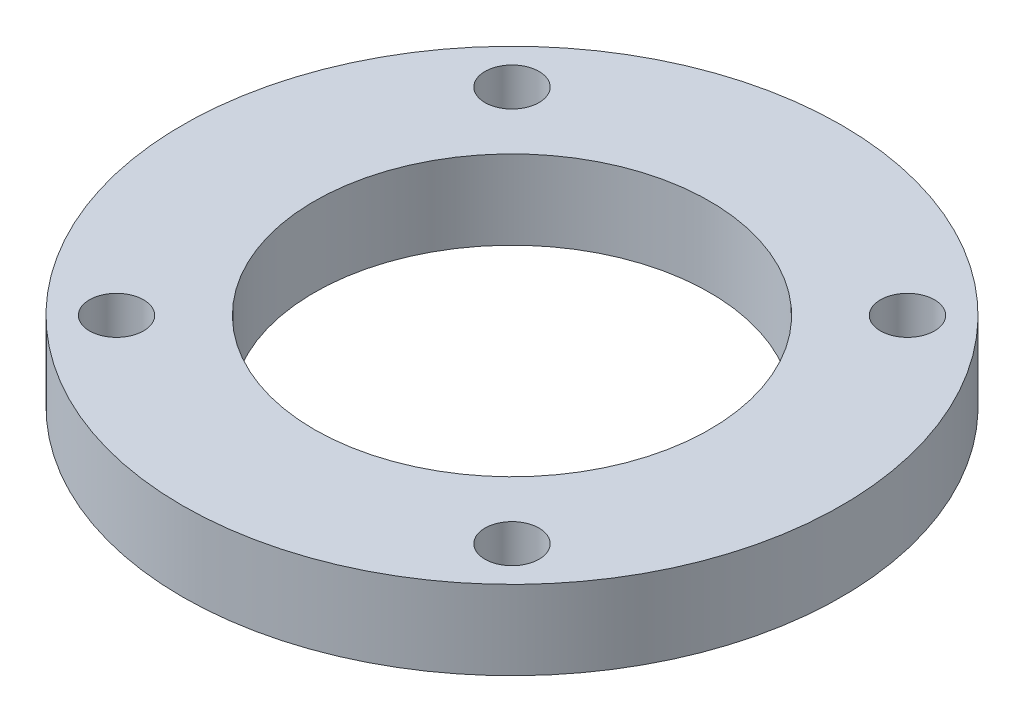
from build123d import *

# Parameters (mm, degrees)
SKETCH_1_R          = 25
SKETCH_1_R_2        = 2.05
EXTRUDE_1_DEPTH     = 6
SKETCH_2_R          = 15
CUT_EXTRUDE_1_DEPTH = 36.860842154


with BuildPart() as part:
    # 草图1 → 凸台-拉伸1 (new body)
    with BuildSketch(Plane(origin=(0, 0, 0), x_dir=(1, 0, 0), z_dir=(0, 1, 0))):
        with Locations(Location((0, 0, 0), (0, 0, 270))):
            Circle(SKETCH_1_R)
        with Locations(Location((-15, 15, 0), (0, 0, 270))):
            Circle(SKETCH_1_R_2, mode=Mode.SUBTRACT)
        with Locations(Location((15, 15, 0), (0, 0, 270))):
            Circle(SKETCH_1_R_2, mode=Mode.SUBTRACT)
        with Locations(Location((15, -15, 0), (0, 0, 270))):
            Circle(SKETCH_1_R_2, mode=Mode.SUBTRACT)
        with Locations(Location((-15, -15, 0), (0, 0, 270))):
            Circle(SKETCH_1_R_2, mode=Mode.SUBTRACT)
    extrude(amount=EXTRUDE_1_DEPTH)

    # 草图2 → 切除-拉伸1 (cut, through all)
    with BuildSketch(Plane(origin=(0, 6, 0), x_dir=(1, 0, 0), z_dir=(0, 1, 0))):
        with Locations(Location((0, 0, 0), (0, 0, 270))):
            Circle(SKETCH_2_R)
    extrude(amount=-CUT_EXTRUDE_1_DEPTH, mode=Mode.SUBTRACT)


solid = part.part
